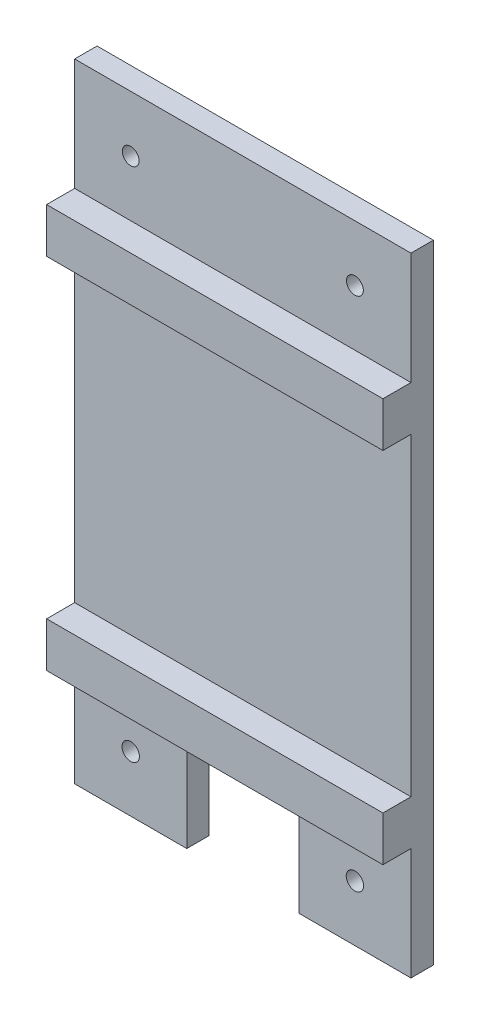
from build123d import *

# Parameters (mm, degrees)
SALIENTE_EXTRUIR1_DEPTH = 4
CROQUIS2_W              = 60
CROQUIS2_H              = 8
SALIENTE_EXTRUIR2_DEPTH = 5
CROQUIS3_R              = 1.55
CROQUIS3_R_2            = 1.5
CORTAR_EXTRUIR1_DEPTH   = 64.725975865


with BuildPart() as part:
    # Croquis1 → Saliente-Extruir1 (new body)
    with BuildSketch(Plane.XY):
        Polygon((10, -36), (10, -56), (30, -56), (30, 56), (-30, 56), (-30, -56), (-10, -56), (-10, -36), align=None)
    extrude(amount=SALIENTE_EXTRUIR1_DEPTH)

    # Croquis2 → Saliente-Extruir2 (add)
    with BuildSketch(Plane.XY.offset(4)):
        with Locations((0, 32)):
            Rectangle(CROQUIS2_W, CROQUIS2_H)
        with Locations((0, -32)):
            Rectangle(CROQUIS2_W, CROQUIS2_H)
    extrude(amount=SALIENTE_EXTRUIR2_DEPTH)

    # Croquis3 → Cortar-Extruir1 (cut, through all)
    with BuildSketch(Plane.XY.offset(4)):
        with Locations((-20, -46)):
            Circle(CROQUIS3_R)
        with Locations((20, -46)):
            Circle(CROQUIS3_R)
        with Locations((-20, 46)):
            Circle(CROQUIS3_R_2)
        with Locations((20, 46)):
            Circle(CROQUIS3_R_2)
    extrude(amount=-CORTAR_EXTRUIR1_DEPTH, mode=Mode.SUBTRACT)


solid = part.part
